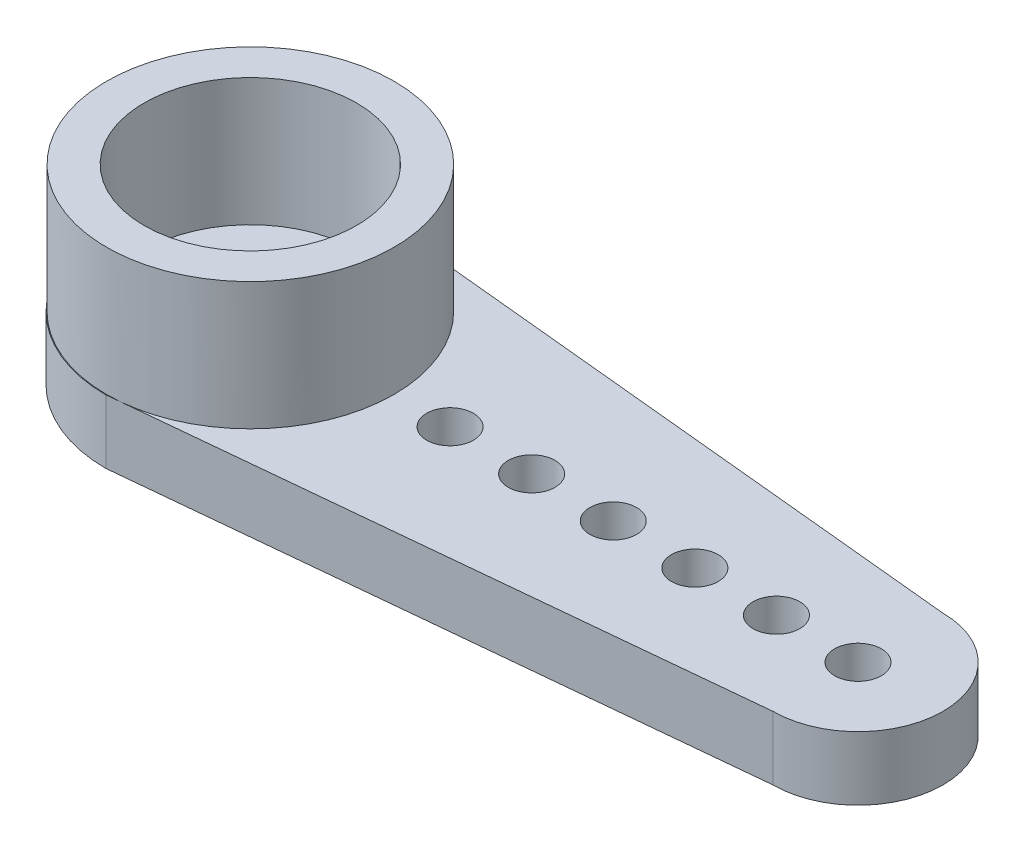
from build123d import *

# Parameters (mm, degrees)
BOSS_EXTRUDE1_DEPTH = 1.5
SKETCH2_R           = 3.38382201
BOSS_EXTRUDE2_DEPTH = 4.5
SKETCH3_R           = 2.5
CUT_EXTRUDE1_DEPTH  = 3
SKETCH4_R           = 1
CUT_EXTRUDE2_DEPTH  = 3.5
SKETCH5_R           = 0.55
CUT_EXTRUDE3_DEPTH  = 3.5
SCALE1_SCALE        = 2


with BuildPart() as part:
    # Sketch1 → Boss-Extrude1 (new body)
    with BuildSketch(Plane(origin=(0, 0, 0), x_dir=(1, 0, 0), z_dir=(0, 1, 0))):
        with BuildLine():
            Line((0.659413902, 3.335441996), (0, 3.4))
            ThreePointArc((0, 3.4), (-3.4, 0), (0, -3.4))
            Line((0, -3.4), (0.659413902, -3.335441996))
            Line((0.659413902, -3.335441996), (14.3, -2))
            ThreePointArc((14.3, -2), (16.3, 0), (14.3, 2))
            Line((14.3, 2), (0.659413902, 3.335441996))
        make_face()
    extrude(amount=BOSS_EXTRUDE1_DEPTH)

    # Sketch2 → Boss-Extrude2 (add)
    with BuildSketch(Plane.XZ):
        with Locations(Location((0, 0, 0), (0, 0, 270))):
            Circle(SKETCH2_R)
    extrude(amount=-BOSS_EXTRUDE2_DEPTH)

    # Sketch3 → Cut-Extrude1 (cut)
    with BuildSketch(Plane(origin=(0, 4.5, 0), x_dir=(1, 0, 0), z_dir=(0, 1, 0))):
        with Locations(Location((0, 0, 0), (0, 0, 270))):
            Circle(SKETCH3_R)
    extrude(amount=-CUT_EXTRUDE1_DEPTH, mode=Mode.SUBTRACT)

    # Sketch4 → Cut-Extrude2 (cut)
    with BuildSketch(Plane(origin=(0, 1.5, 0), x_dir=(1, 0, 0), z_dir=(0, 1, 0))):
        with Locations(Location((0, 0, 0), (0, 0, 270))):
            Circle(SKETCH4_R)
    extrude(amount=-CUT_EXTRUDE2_DEPTH, mode=Mode.SUBTRACT)

    # Sketch5 → Cut-Extrude3 (cut)
    with BuildSketch(Plane.XZ):
        with Locations(Location((14.3, 0, 0), (0, 0, 270))):
            Circle(SKETCH5_R)
        with Locations(Location((12.38, 0, 0), (0, 0, 270))):
            Circle(SKETCH5_R)
        with Locations(Location((10.46, 0, 0), (0, 0, 270))):
            Circle(SKETCH5_R)
        with Locations(Location((8.54, 0, 0), (0, 0, 270))):
            Circle(SKETCH5_R)
        with Locations(Location((6.62, 0, 0), (0, 0, 270))):
            Circle(SKETCH5_R)
        with Locations(Location((4.7, 0, 0), (0, 0, 270))):
            Circle(SKETCH5_R)
    extrude(amount=-CUT_EXTRUDE3_DEPTH, mode=Mode.SUBTRACT)


with BuildPart() as part_1:
    # Scale1: scaled about (4.137469707, 1.335828051, 0)
    add(part.part.scale(SCALE1_SCALE).moved(Location((-4.137469707, -1.335828051, 0))))


solid = part_1.part
